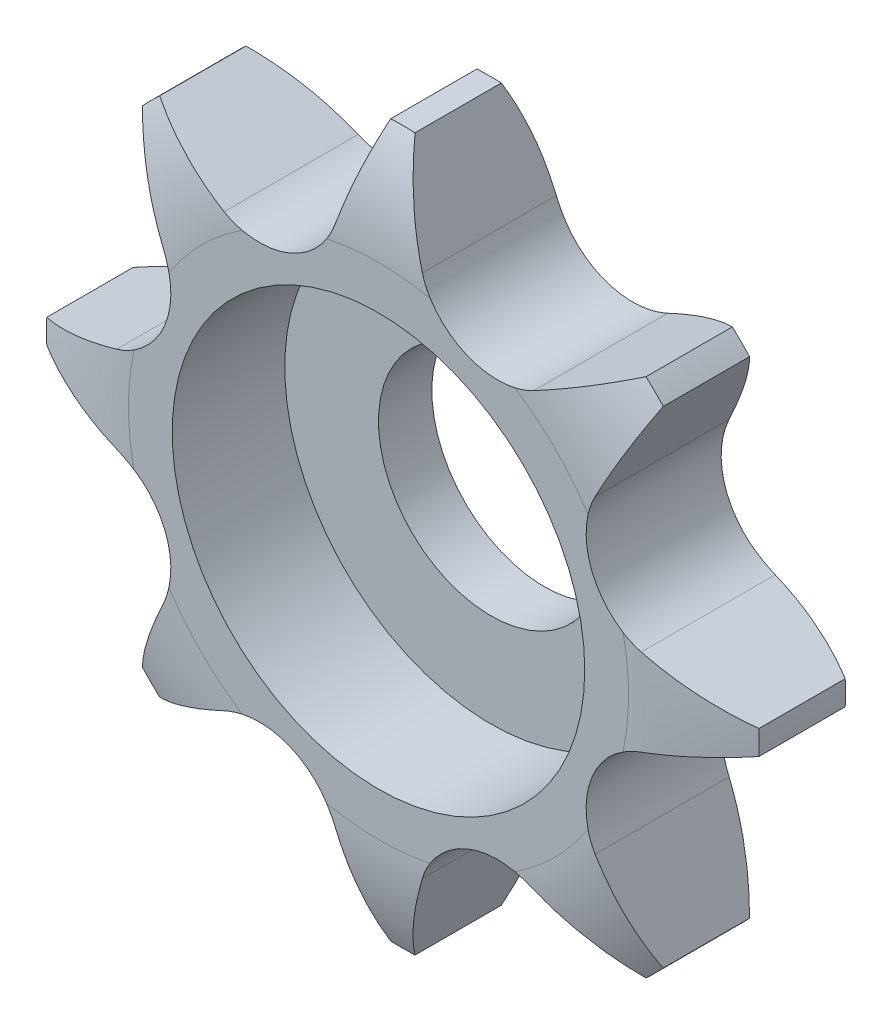
from build123d import *

# Parameters (mm, degrees)
CUT_EXTRUDE_1_DEPTH      = 37.701498607
PATTERN_CIRCULAR_1_COUNT = 8
SKETCH_14_R              = 6
CUT_EXTRUDE_5_DEPTH      = 28
SKETCH_15_R              = 11
CUT_EXTRUDE_6_DEPTH      = 6
CUT_EXTRUDE_7_DEPTH      = 37.701498779
CUT_EXTRUDE_7_DEPTH_BACK = 37.701498779


with BuildPart() as part:
    # 草图4 → 旋转1 (revolve)
    with BuildSketch(Plane(origin=(0, 0, 0), x_dir=(0, 0, -1), z_dir=(1, 0, 0))):
        with BuildLine():
            Line((0, 10), (-17.8, 10))
            Line((-17.8, 10), (-17.8, 13.333431373))
            ThreePointArc((-17.8, 13.333431373), (-18.129167352, 16.240319744), (-19.1, 19))
            Line((-19.1, 19), (-23.7, 19))
            ThreePointArc((-23.7, 19), (-24.670832648, 16.240319744), (-25, 13.333431373))
            Line((-25, 13.333431373), (-25, 5))
            Line((-25, 5), (0, 5))
            Line((0, 5), (0, 10))
        make_face()
    revolve(axis=Axis((0, 0, 0), (0, 0, 1)))

    # 草图5 → 切除-拉伸1 (cut, through all)
    with BuildSketch(Plane.XY):
        with BuildLine():
            Line((0.65, 18.988878324), (2.31192381, 13.985375154))
            ThreePointArc((2.31192381, 13.985375154), (4.721353225, 11.395659205), (8.256304086, 11.522549751))
            Line((8.256304086, 11.522549751), (12.969867869, 13.884614776))
            ThreePointArc((12.969867869, 13.884614776), (7.272453285, 17.553102951), (0.65, 18.988878324))
        make_face()
    cut_extrude_1 = extrude(amount=CUT_EXTRUDE_1_DEPTH, mode=Mode.SUBTRACT)

    # 阵列(圆周)1: 切除-拉伸1 ×8 about axis
    pattern_circular_1_axis = Axis((0, 0, 0), (0, 0, 1))
    for i in range(1, PATTERN_CIRCULAR_1_COUNT):
        add(cut_extrude_1.rotate(pattern_circular_1_axis, i * 360 / PATTERN_CIRCULAR_1_COUNT), mode=Mode.SUBTRACT)

    # 草图14 → 切除-拉伸5 (cut)
    with BuildSketch(Plane.XY.offset(25)):
        Circle(SKETCH_14_R)
    extrude(amount=-CUT_EXTRUDE_5_DEPTH, mode=Mode.SUBTRACT)

    # 草图15 → 切除-拉伸6 (cut)
    with BuildSketch(Plane.XY.offset(25)):
        Circle(SKETCH_15_R)
    extrude(amount=-CUT_EXTRUDE_6_DEPTH, mode=Mode.SUBTRACT)

    # 草图16 → 切除-拉伸7 (cut, two sides: drawn at the far end of the back side and taken through both)
    with BuildSketch(Plane(origin=(0, 0, 0), x_dir=(1, 0, 0), z_dir=(0, 1, 0)).offset(-CUT_EXTRUDE_7_DEPTH_BACK)):
        Polygon((-109.354391609, -14.859816975), (-15.287230377, -16.039870969), (19.672911223, -16.478439053), (113.740072455, -17.658493047), (116.100180443, 170.475829416), (-106.994283621, 173.274505489), align=None)
    extrude(amount=CUT_EXTRUDE_7_DEPTH + CUT_EXTRUDE_7_DEPTH_BACK, mode=Mode.SUBTRACT)


solid = part.part
